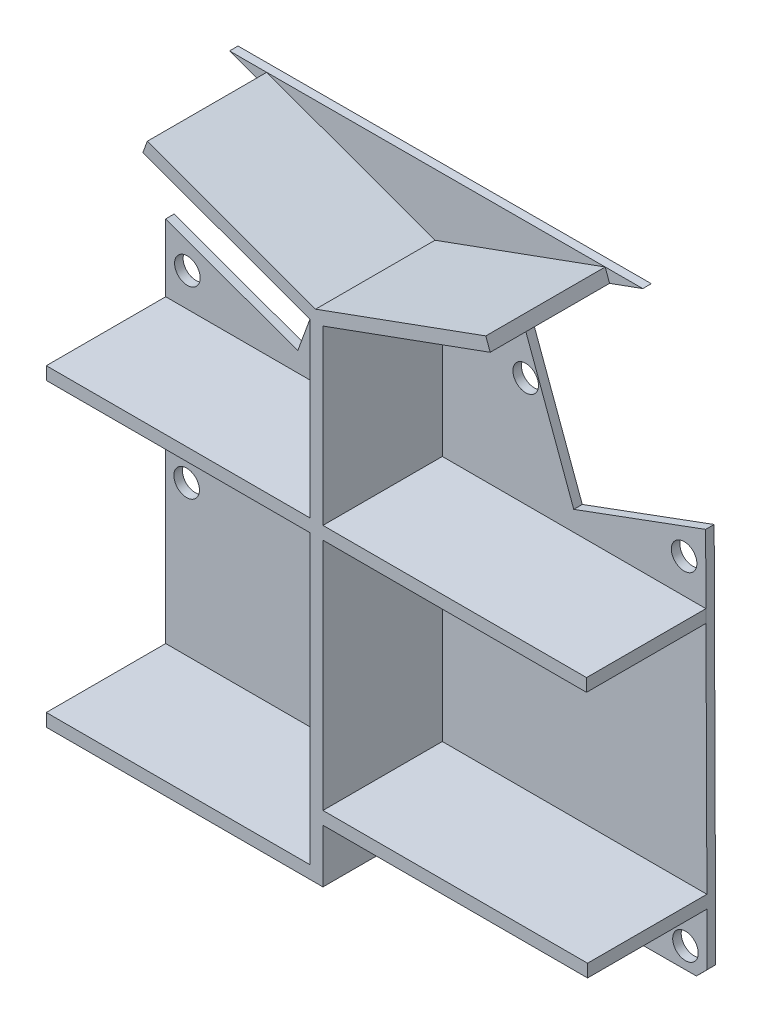
from build123d import *

# Parameters (mm, degrees)
SKETCH9_R           = 1.4986
BOSS_EXTRUDE2_DEPTH = 1
BOSS_EXTRUDE8_DEPTH = 1
BOSS_EXTRUDE3_DEPTH = 14
SKETCH12_W          = 63.348303519
SKETCH12_H          = 1.5
BOSS_EXTRUDE4_DEPTH = 14


with BuildPart() as part:
    # Sketch9 → Boss-Extrude2 (new body)
    with BuildSketch(Plane.XY):
        Polygon((0, 45.894331692), (15.488494665, 40.257085472), (21.11579715, 55.718259441), (31.638563481, 55.718259441), (42.161245631, 55.760350338), (47.850347546, 40.321809178), (63.316169409, 46.020964031), (63.494666021, 1.396989332), (62.229756161, 0.121919512), (31.75, 0), (1.27, 0), (0, 1.27), align=None)
        with Locations((60.94984, 2.54)):
            Circle(SKETCH9_R, mode=Mode.SUBTRACT)
        with Locations((21.082, 50.8)):
            Circle(SKETCH9_R, mode=Mode.SUBTRACT)
        with Locations((2.54, 41.91)):
            Circle(SKETCH9_R, mode=Mode.SUBTRACT)
        with Locations(Location((60.792126991, 42.026504254, 0), (0, 0, 180))):
            Circle(SKETCH9_R, mode=Mode.SUBTRACT)
        with Locations(Location((42.214715469, 50.842265431, 0), (0, 0, 180))):
            Circle(SKETCH9_R, mode=Mode.SUBTRACT)
        with Locations((2.45872, 20.32)):
            Circle(SKETCH9_R, mode=Mode.SUBTRACT)
    extrude(amount=BOSS_EXTRUDE2_DEPTH)

    # Sketch13 → Boss-Extrude8 (add)
    with BuildSketch(Plane(origin=(0, 0, 0), x_dir=(-1, 0, 0), z_dir=(0, 0, -1))):
        Polygon((-21.11579715, 55.718259441), (-23.047346454, 61.025246209), (-7.480797331, 66.691011442), (-55.947053109, 66.787943953), (-40.208483916, 61.059568484), (-42.161245631, 55.760350338), (-27.798035754, 50.098344964), align=None)
    extrude(amount=-BOSS_EXTRUDE8_DEPTH)

    # Sketch11 → Boss-Extrude3 (add)
    with BuildSketch(Plane.XY.offset(1)):
        Polygon((32.438774093, 58.231623033), (32.438774093, 9.039988), (63.464093904, 9.039988), (63.47009388, 7.54), (32.438774093, 7.54), (32.438774093, 1.27), (0, 1.27), (0, 2.77), (30.940876447, 2.77), (30.940876447, 58.152233865), (11.329502605, 65.290196119), (11.842533196, 66.699734913), (31.580765387, 59.515599958), (51.537117344, 66.779124082), (52.050147935, 65.369585287), align=None)
    extrude(amount=BOSS_EXTRUDE3_DEPTH)

    # Sketch12 → Boss-Extrude4 (add)
    with BuildSketch(Plane.XY.offset(1)):
        with Locations((31.67415176, 37.237468453)):
            Rectangle(SKETCH12_W, SKETCH12_H)
    extrude(amount=BOSS_EXTRUDE4_DEPTH)


solid = part.part
